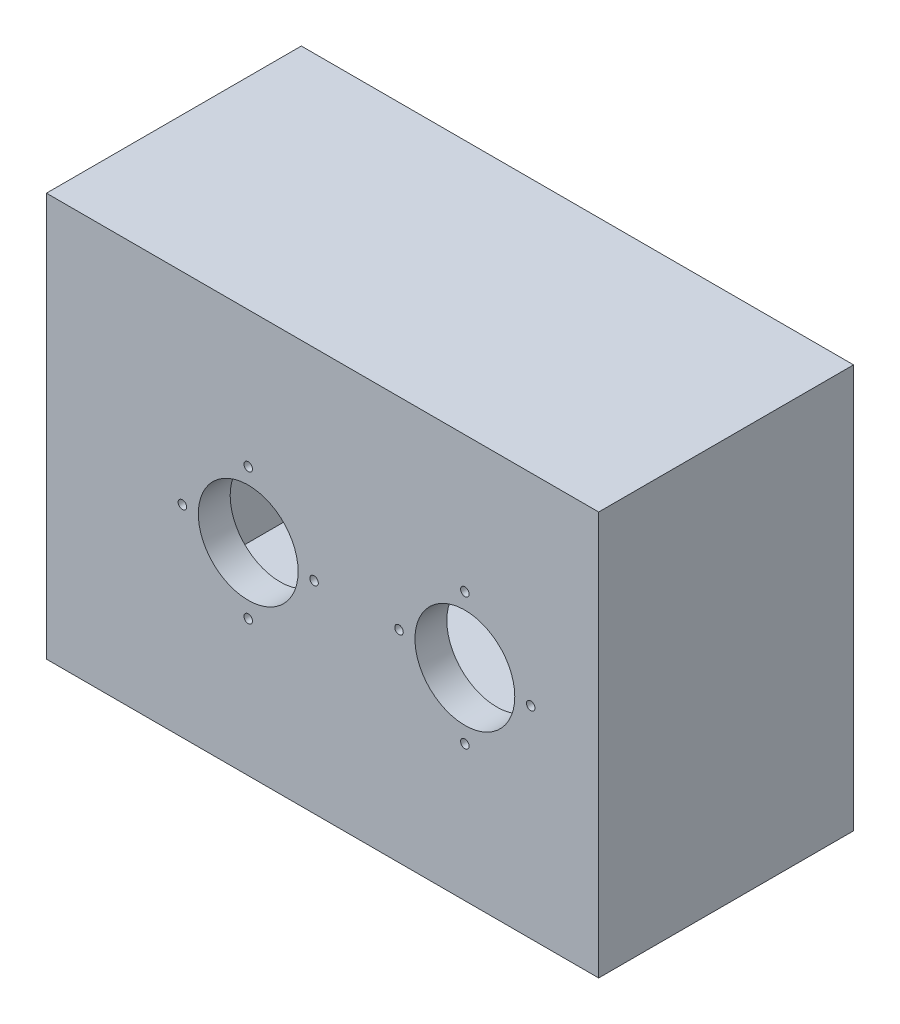
from build123d import *

# Parameters (mm, degrees)
SKETCH1_W           = 260
SKETCH1_H           = 120
BOSS_EXTRUDE1_DEPTH = 190
SHELL1_T            = 15
SKETCH2_R           = 15
CUT_EXTRUDE1_DEPTH  = 260.615099715
SKETCH3_R           = 23.5
CUT_EXTRUDE2_DEPTH  = 260.615099715
SKETCH4_R           = 2
CUT_EXTRUDE3_DEPTH  = 260.615099715


with BuildPart() as part:
    # Sketch1 → Boss-Extrude1 (new body)
    with BuildSketch(Plane(origin=(0, 0, 0), x_dir=(1, 0, 0), z_dir=(0, 1, 0))):
        Rectangle(SKETCH1_W, SKETCH1_H)
    extrude(amount=BOSS_EXTRUDE1_DEPTH)

    # Shell1 (no face opened: a closed hollow body)
    add(offset(amount=-SHELL1_T, mode=Mode.PRIVATE), mode=Mode.SUBTRACT)

    # Sketch2 → Cut-Extrude1 (cut, through all)
    with BuildSketch(Plane.XY.offset(60)):
        with Locations((-35, 95)):
            Circle(SKETCH2_R)
        with Locations((67, 95)):
            Circle(SKETCH2_R)
    extrude(amount=-CUT_EXTRUDE1_DEPTH, mode=Mode.SUBTRACT)

    # Sketch3 → Cut-Extrude2 (cut, through all)
    with BuildSketch(Plane.XY.offset(60)):
        with Locations((-35, 95)):
            Circle(SKETCH3_R)
        with Locations((67, 95)):
            Circle(SKETCH3_R)
    extrude(amount=-CUT_EXTRUDE2_DEPTH, mode=Mode.SUBTRACT)

    # Sketch4 → Cut-Extrude3 (cut, through all)
    with BuildSketch(Plane.XY.offset(60)):
        with Locations((36, 95)):
            Circle(SKETCH4_R)
        with Locations((67, 126)):
            Circle(SKETCH4_R)
        with Locations((98, 95)):
            Circle(SKETCH4_R)
        with Locations((67, 64)):
            Circle(SKETCH4_R)
        with Locations((-4, 95)):
            Circle(SKETCH4_R)
        with Locations((-35, 64)):
            Circle(SKETCH4_R)
        with Locations((-66, 95)):
            Circle(SKETCH4_R)
        with Locations((-35, 126)):
            Circle(SKETCH4_R)
    extrude(amount=-CUT_EXTRUDE3_DEPTH, mode=Mode.SUBTRACT)


solid = part.part
